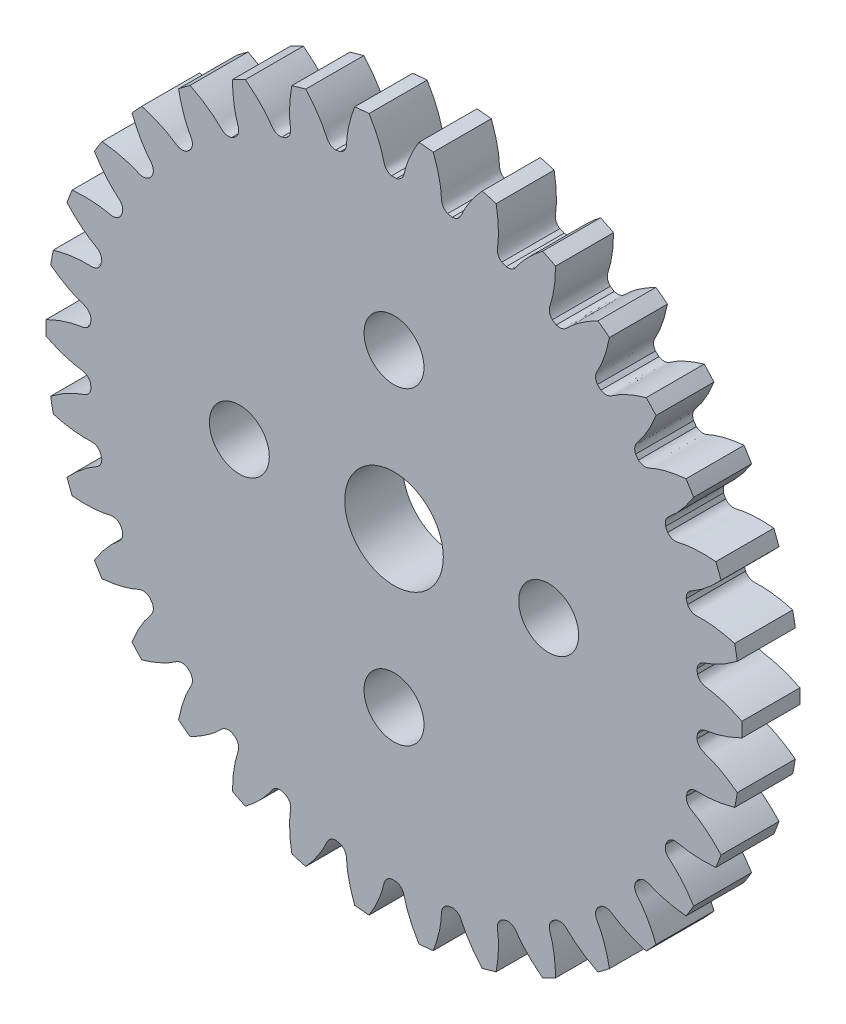
from build123d import *

# Parameters (mm, degrees)
SKETCH_1_R               = 18
EXTRUDE_1_DEPTH          = 5
CUT_EXTRUDE_1_DEPTH      = 26.942243542
PATTERN_CIRCULAR_1_COUNT = 34
SKETCH_4_R               = 2.55
SKETCH_4_R_2             = 1.55
CUT_EXTRUDE_2_DEPTH      = 10
SKETCH_5_R               = 416.736328174
CUT_EXTRUDE_3_DEPTH      = 2


with BuildPart() as part:
    # 草图1 → 凸台-拉伸1 (new body)
    with BuildSketch(Plane.XY):
        Circle(SKETCH_1_R)
    extrude(amount=EXTRUDE_1_DEPTH)

    # 草图2 → 切除-拉伸1 (cut, through all)
    with BuildSketch(Plane.XY):
        with BuildLine():
            ThreePointArc((0.122114117, 15.749526601), (0, 15.75), (-0.122114117, 15.749526601))
            add(Edge.make_bspline(
                [(-0.122114117, 15.749526601), (-0.477725204, 15.850075264), (-0.508940263, 16.12585821), (-0.586630904, 16.415753264), (-0.608620239, 16.492163881), (-0.634056163, 16.574209555), (-0.66312886, 16.661799985), (-0.696082436, 16.754814275), (-0.733140751, 16.85313156), (-0.774529328, 16.956621962), (-0.820468617, 17.065149384), (-0.871175742, 17.178570806), (-0.926863754, 17.296736618), (-0.987741617, 17.419490647), (-1.054013984, 17.54667029), (-1.125881037, 17.678106613), (-1.203538314, 17.813624471), (-1.287176542, 17.953042626), (-1.376981469, 18.096173869), (-1.473133704, 18.242825148), (-1.57580856, 18.3927977), (-1.685175894, 18.545887189), (-1.801399959, 18.701883839), (-1.924639251, 18.860572583), (-2.055046369, 19.021733208), (-2.192767866, 19.185140508), (-2.337944119, 19.350564432), (-2.490709186, 19.517770252), (-2.651190693, 19.686518714), (-2.819509645, 19.85656621), (-3.05759441, 20.087665048), (-3.243727872, 20.257667207), (-3.371575564, 20.369944362)],
                knots=[0, 0, 0, 0, 0.13072362, 0.143503881, 0.157401081, 0.17241522, 0.188546299, 0.205794316, 0.224159273, 0.243641169, 0.264240005, 0.285955779, 0.308788493, 0.332738146, 0.357804738, 0.383988269, 0.411288739, 0.439706149, 0.469240498, 0.499891786, 0.531660014, 0.56454518, 0.598547286, 0.633666331, 0.669902315, 0.707255238, 0.745725101, 0.785311903, 0.826015644, 0.867836324, 0.910773943, 1, 1, 1, 1], degree=3))
            ThreePointArc((-3.371575564, 20.369944362), (0, 20.647085874), (3.371575564, 20.369944362))
            add(Edge.make_bspline(
                [(0.122114117, 15.749526601), (0.477725204, 15.850075264), (0.508940263, 16.12585821), (0.586630904, 16.415753264), (0.608620239, 16.492163881), (0.634056163, 16.574209555), (0.66312886, 16.661799985), (0.696082436, 16.754814275), (0.733140751, 16.85313156), (0.774529328, 16.956621962), (0.820468617, 17.065149384), (0.871175742, 17.178570806), (0.926863754, 17.296736618), (0.987741617, 17.419490647), (1.054013984, 17.54667029), (1.125881037, 17.678106613), (1.203538314, 17.813624471), (1.287176542, 17.953042626), (1.376981469, 18.096173869), (1.473133704, 18.242825148), (1.57580856, 18.3927977), (1.685175894, 18.545887189), (1.801399959, 18.701883839), (1.924639251, 18.860572583), (2.055046369, 19.021733208), (2.192767866, 19.185140508), (2.337944119, 19.350564432), (2.490709186, 19.517770252), (2.651190693, 19.686518714), (2.819509645, 19.85656621), (3.05759441, 20.087665048), (3.243727872, 20.257667207), (3.371575564, 20.369944362)],
                knots=[0, 0, 0, 0, 0.13072362, 0.143503881, 0.157401081, 0.17241522, 0.188546299, 0.205794316, 0.224159273, 0.243641169, 0.264240005, 0.285955779, 0.308788493, 0.332738146, 0.357804738, 0.383988269, 0.411288739, 0.439706149, 0.469240498, 0.499891786, 0.531660014, 0.56454518, 0.598547286, 0.633666331, 0.669902315, 0.707255238, 0.745725101, 0.785311903, 0.826015644, 0.867836324, 0.910773943, 1, 1, 1, 1], degree=3))
        make_face()
    cut_extrude_1 = extrude(amount=CUT_EXTRUDE_1_DEPTH, mode=Mode.SUBTRACT)

    # 阵列(圆周)1: 切除-拉伸1 ×34 about axis
    pattern_circular_1_axis = Axis((0, 0, 5), (0, 0, -1))
    for i in range(1, PATTERN_CIRCULAR_1_COUNT):
        add(cut_extrude_1.rotate(pattern_circular_1_axis, i * 360 / PATTERN_CIRCULAR_1_COUNT), mode=Mode.SUBTRACT)

    # 草图4 → 切除-拉伸2 (cut)
    with BuildSketch(Plane.XY.offset(5)):
        Circle(SKETCH_4_R)
        with Locations((8, 0)):
            Circle(SKETCH_4_R_2)
        with Locations((0, -8)):
            Circle(SKETCH_4_R_2)
        with Locations((-8, 0)):
            Circle(SKETCH_4_R_2)
        with Locations((0, 8)):
            Circle(SKETCH_4_R_2)
    extrude(amount=-CUT_EXTRUDE_2_DEPTH, mode=Mode.SUBTRACT)

    # 草图5 → 切除-拉伸3 (cut)
    with BuildSketch(Plane.XY.offset(5)):
        with Locations((-132.599534091, 117.391602188)):
            Circle(SKETCH_5_R)
    extrude(amount=-CUT_EXTRUDE_3_DEPTH, mode=Mode.SUBTRACT)


solid = part.part
